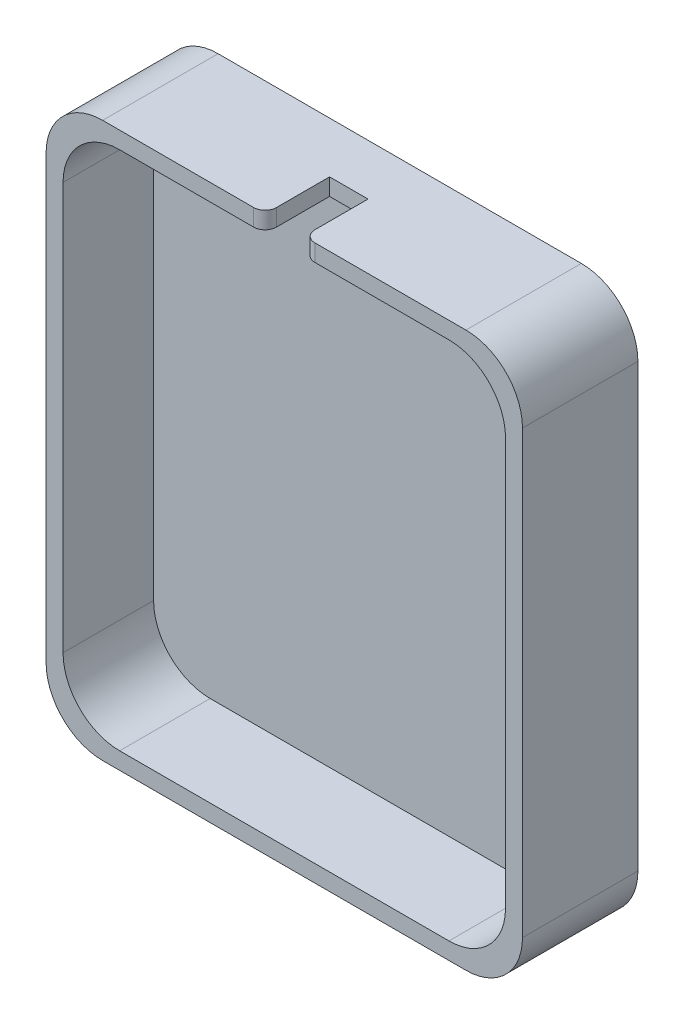
from build123d import *

# Parameters (mm, degrees)
SKETCH1_W           = 42.1
SKETCH1_H           = 49
SKETCH1_W_2         = 39.1
SKETCH1_H_2         = 46
BOSS_EXTRUDE1_DEPTH = 8
SKETCH1_2_W         = 42.1
SKETCH1_2_H         = 49
BOSS_EXTRUDE2_DEPTH = 2.2
FILLET1_R           = 5
SKETCH2_W           = 3.4
SKETCH2_H           = 5.7
CUT_EXTRUDE1_DEPTH  = 1.5
FILLET2_R           = 1
SKETCH3_R           = 1.375
CUT_EXTRUDE2_DEPTH  = 2.2
SKETCH4_R           = 1.5
BOSS_EXTRUDE3_DEPTH = 0.2


with BuildPart() as part:
    # Sketch1 → Boss-Extrude1 (new body)
    with BuildSketch(Plane.XY):
        Rectangle(SKETCH1_W, SKETCH1_H)
        Rectangle(SKETCH1_W_2, SKETCH1_H_2, mode=Mode.SUBTRACT)
    extrude(amount=BOSS_EXTRUDE1_DEPTH)

    # Sketch1<2> → Boss-Extrude2 (add)
    with BuildSketch(Plane.XY):
        Rectangle(SKETCH1_2_W, SKETCH1_2_H)
    extrude(amount=-BOSS_EXTRUDE2_DEPTH)

    # Fillet1
    fillet1_edges = [part.edges().sort_by_distance(p)[0] for p in [
        (-19.55, 23, 4),
        (-19.55, -23, 4),
        (19.55, -23, 4),
        (19.55, 23, 4),
        (-21.05, 24.5, 2.9),
        (21.05, 24.5, 2.9),
        (21.05, -24.5, 2.9),
        (-21.05, -24.5, 2.9),
    ]]
    fillet(fillet1_edges, radius=FILLET1_R)

    # Sketch2 → Cut-Extrude1 (cut)
    with BuildSketch(Plane(origin=(0, 24.5, 0), x_dir=(1, 0, 0), z_dir=(0, 1, 0))):
        with Locations((0, -5.15)):
            Rectangle(SKETCH2_W, SKETCH2_H)
    extrude(amount=-CUT_EXTRUDE1_DEPTH, mode=Mode.SUBTRACT)

    # Fillet2
    fillet2_edges = [part.edges().sort_by_distance(p)[0] for p in [
        (1.7, 23.75, 8),
        (-1.7, 23.75, 8),
    ]]
    fillet(fillet2_edges, radius=FILLET2_R)

    # Sketch3 → Cut-Extrude2 (cut)
    with BuildSketch(Plane.XY):
        with Locations((0, 9.8)):
            Circle(SKETCH3_R)
        with Locations((-9.75, 0)):
            Circle(SKETCH3_R)
        with Locations((0, -9.8)):
            Circle(SKETCH3_R)
        with Locations((9.75, 0)):
            Circle(SKETCH3_R)
    extrude(amount=-CUT_EXTRUDE2_DEPTH, mode=Mode.SUBTRACT)

    # Sketch4 → Boss-Extrude3 (add)
    with BuildSketch(Plane.XY):
        with Locations((-9.75, 0)):
            Circle(SKETCH4_R)
        with Locations((0, 9.8)):
            Circle(SKETCH4_R)
        with Locations((9.75, 0)):
            Circle(SKETCH4_R)
        with Locations((0, -9.8)):
            Circle(SKETCH4_R)
    extrude(amount=-BOSS_EXTRUDE3_DEPTH)


solid = part.part
